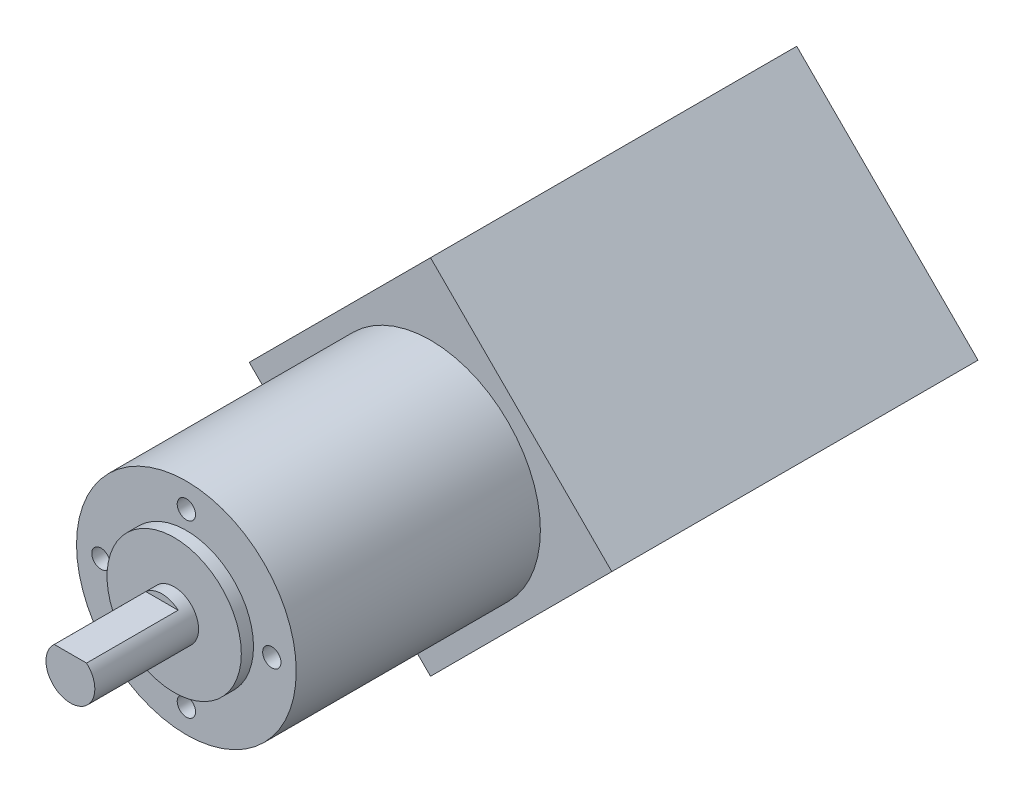
from build123d import *

# Parameters (mm, degrees)
EXTRUDE_1_DEPTH     = 60
SKETCH_2_R          = 18
EXTRUDE_2_DEPTH     = 40
SKETCH_3_R          = 11
EXTRUDE_3_DEPTH     = 2
SKETCH_4_R          = 4
EXTRUDE_4_DEPTH     = 17
SKETCH_5_R          = 1.5
CUT_EXTRUDE_1_DEPTH = 4
CUT_EXTRUDE_START   = -15
CUT_EXTRUDE_2_DEPTH = 15


with BuildPart() as part:
    # 草图1 → 凸台-拉伸1 (new body)
    with BuildSketch(Plane.XY):
        Polygon((-29.69848481, 0), (0, 29.69848481), (29.69848481, 0), (0, -29.69848481), align=None)
    extrude(amount=EXTRUDE_1_DEPTH)

    # 草图2 → 凸台-拉伸2 (add)
    with BuildSketch(Plane.XY.offset(60)):
        Circle(SKETCH_2_R)
    extrude(amount=EXTRUDE_2_DEPTH)

    # 草图3 → 凸台-拉伸3 (add)
    with BuildSketch(Plane.XY.offset(100)):
        Circle(SKETCH_3_R)
    extrude(amount=EXTRUDE_3_DEPTH)

    # 草图4 → 凸台-拉伸4 (add)
    with BuildSketch(Plane.XY.offset(102)):
        Circle(SKETCH_4_R)
    extrude(amount=EXTRUDE_4_DEPTH)

    # 草图5 → 切除-拉伸1 (cut)
    with BuildSketch(Plane.XY.offset(100)):
        with Locations((0, 14)):
            Circle(SKETCH_5_R)
        with Locations((14, 0)):
            Circle(SKETCH_5_R)
        with Locations((0, -14)):
            Circle(SKETCH_5_R)
        with Locations((-14, 0)):
            Circle(SKETCH_5_R)
    extrude(amount=-CUT_EXTRUDE_1_DEPTH, mode=Mode.SUBTRACT)

    # 草图6 → 切除-拉伸2 (cut)
    with BuildSketch(Plane.XY.offset(119).offset(CUT_EXTRUDE_START)):
        with BuildLine():
            Line((2.645751311, 3), (-2.645751311, 3))
            ThreePointArc((-2.645751311, 3), (0, 4), (2.645751311, 3))
        make_face()
    extrude(amount=CUT_EXTRUDE_2_DEPTH, mode=Mode.SUBTRACT)


solid = part.part
